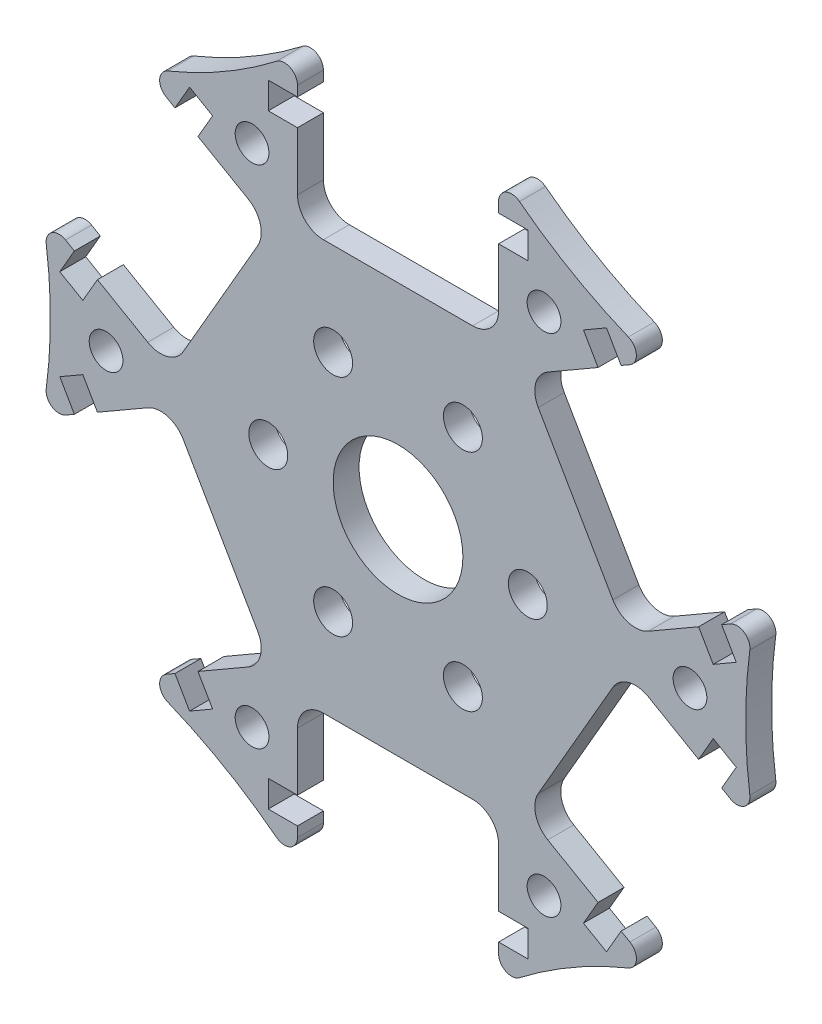
from build123d import *

# Parameters (mm, degrees)
SKETCH_1_R          = 28.3
EXTRUDE_1_DEPTH     = 2
SKETCH_2_R          = 5
SKETCH_2_R_2        = 1.5
SKETCH_2_R_3        = 1.3
CUT_EXTRUDE_1_DEPTH = 41.072184867
CUT_EXTRUDE_3_DEPTH = 40.315613947
FILLET_2_R          = 2
FILLET_1_R          = 1


with BuildPart() as part:
    # ｽｹｯﾁ1 → ﾎﾞｽ - 押し出し1 (new body)
    with BuildSketch(Plane.XY):
        Circle(SKETCH_1_R)
    extrude(amount=EXTRUDE_1_DEPTH)

    # ｽｹｯﾁ2 → ｶｯﾄ - 押し出し1 (cut, through all)
    with BuildSketch(Plane.XY.offset(2)):
        Circle(SKETCH_2_R)
        with Locations((5, 8.660254038)):
            Circle(SKETCH_2_R_2)
        with Locations((10, 0)):
            Circle(SKETCH_2_R_2)
        with Locations((5, -8.660254038)):
            Circle(SKETCH_2_R_2)
        with Locations((-5, -8.660254038)):
            Circle(SKETCH_2_R_2)
        with Locations((-10, 0)):
            Circle(SKETCH_2_R_2)
        with Locations((-5, 8.660254038)):
            Circle(SKETCH_2_R_2)
        with Locations((11.25, 19.485571585)):
            Circle(SKETCH_2_R_3)
        with Locations((22.5, 0)):
            Circle(SKETCH_2_R_3)
        with Locations((11.25, -19.485571585)):
            Circle(SKETCH_2_R_3)
        with Locations((-11.25, -19.485571585)):
            Circle(SKETCH_2_R_3)
        with Locations((-22.5, 0)):
            Circle(SKETCH_2_R_3)
        with Locations((-11.25, 19.485571585)):
            Circle(SKETCH_2_R_3)
        with BuildLine():
            Line((7.75, 24.325), (10, 24.325))
            Line((10, 24.325), (10, 22.275))
            Line((10, 22.275), (7.75, 22.275))
            Line((7.75, 22.275), (7.75, 15.8))
            Line((7.75, 15.8), (-7.75, 15.8))
            Line((-7.75, 15.8), (-7.75, 22.275))
            Line((-7.75, 22.275), (-10, 22.275))
            Line((-10, 22.275), (-10, 24.325))
            Line((-10, 24.325), (-7.75, 24.325))
            Line((-7.75, 24.325), (-7.75, 27.21814652))
            ThreePointArc((-7.75, 27.21814652), (0, 28.3), (7.75, 27.21814652))
            Line((7.75, 27.21814652), (7.75, 24.325))
        make_face()
        with BuildLine():
            Line((24.941067947, 5.450803121), (26.066067947, 3.502245962))
            Line((26.066067947, 3.502245962), (24.290715869, 2.477245962))
            Line((24.290715869, 2.477245962), (23.165715869, 4.425803121))
            Line((23.165715869, 4.425803121), (17.55820138, 1.188303121))
            Line((17.55820138, 1.188303121), (9.80820138, 14.611696879))
            Line((9.80820138, 14.611696879), (15.415715869, 17.849196879))
            Line((15.415715869, 17.849196879), (14.290715869, 19.797754038))
            Line((14.290715869, 19.797754038), (16.066067947, 20.822754038))
            Line((16.066067947, 20.822754038), (17.191067947, 18.874196879))
            Line((17.191067947, 18.874196879), (19.69660633, 20.320770139))
            ThreePointArc((19.69660633, 20.320770139), (24.508518927, 14.15), (27.44660633, 6.897376381))
            Line((27.44660633, 6.897376381), (24.941067947, 5.450803121))
        make_face()
        with BuildLine():
            Line((17.191067947, -18.874196879), (16.066067947, -20.822754038))
            Line((16.066067947, -20.822754038), (14.290715869, -19.797754038))
            Line((14.290715869, -19.797754038), (15.415715869, -17.849196879))
            Line((15.415715869, -17.849196879), (9.80820138, -14.611696879))
            Line((9.80820138, -14.611696879), (17.55820138, -1.188303121))
            Line((17.55820138, -1.188303121), (23.165715869, -4.425803121))
            Line((23.165715869, -4.425803121), (24.290715869, -2.477245962))
            Line((24.290715869, -2.477245962), (26.066067947, -3.502245962))
            Line((26.066067947, -3.502245962), (24.941067947, -5.450803121))
            Line((24.941067947, -5.450803121), (27.44660633, -6.897376381))
            ThreePointArc((27.44660633, -6.897376381), (24.508518927, -14.15), (19.69660633, -20.320770139))
            Line((19.69660633, -20.320770139), (17.191067947, -18.874196879))
        make_face()
        with BuildLine():
            Line((-7.75, -24.325), (-10, -24.325))
            Line((-10, -24.325), (-10, -22.275))
            Line((-10, -22.275), (-7.75, -22.275))
            Line((-7.75, -22.275), (-7.75, -15.8))
            Line((-7.75, -15.8), (7.75, -15.8))
            Line((7.75, -15.8), (7.75, -22.275))
            Line((7.75, -22.275), (10, -22.275))
            Line((10, -22.275), (10, -24.325))
            Line((10, -24.325), (7.75, -24.325))
            Line((7.75, -24.325), (7.75, -27.21814652))
            ThreePointArc((7.75, -27.21814652), (0, -28.3), (-7.75, -27.21814652))
            Line((-7.75, -27.21814652), (-7.75, -24.325))
        make_face()
        with BuildLine():
            Line((-24.941067947, -5.450803121), (-26.066067947, -3.502245962))
            Line((-26.066067947, -3.502245962), (-24.290715869, -2.477245962))
            Line((-24.290715869, -2.477245962), (-23.165715869, -4.425803121))
            Line((-23.165715869, -4.425803121), (-17.55820138, -1.188303121))
            Line((-17.55820138, -1.188303121), (-9.80820138, -14.611696879))
            Line((-9.80820138, -14.611696879), (-15.415715869, -17.849196879))
            Line((-15.415715869, -17.849196879), (-14.290715869, -19.797754038))
            Line((-14.290715869, -19.797754038), (-16.066067947, -20.822754038))
            Line((-16.066067947, -20.822754038), (-17.191067947, -18.874196879))
            Line((-17.191067947, -18.874196879), (-19.69660633, -20.320770139))
            ThreePointArc((-19.69660633, -20.320770139), (-24.508518927, -14.15), (-27.44660633, -6.897376381))
            Line((-27.44660633, -6.897376381), (-24.941067947, -5.450803121))
        make_face()
        with BuildLine():
            Line((-17.191067947, 18.874196879), (-16.066067947, 20.822754038))
            Line((-16.066067947, 20.822754038), (-14.290715869, 19.797754038))
            Line((-14.290715869, 19.797754038), (-15.415715869, 17.849196879))
            Line((-15.415715869, 17.849196879), (-9.80820138, 14.611696879))
            Line((-9.80820138, 14.611696879), (-17.55820138, 1.188303121))
            Line((-17.55820138, 1.188303121), (-23.165715869, 4.425803121))
            Line((-23.165715869, 4.425803121), (-24.290715869, 2.477245962))
            Line((-24.290715869, 2.477245962), (-26.066067947, 3.502245962))
            Line((-26.066067947, 3.502245962), (-24.941067947, 5.450803121))
            Line((-24.941067947, 5.450803121), (-27.44660633, 6.897376381))
            ThreePointArc((-27.44660633, 6.897376381), (-24.508518927, 14.15), (-19.69660633, 20.320770139))
            Line((-19.69660633, 20.320770139), (-17.191067947, 18.874196879))
        make_face()
    extrude(amount=-CUT_EXTRUDE_1_DEPTH, mode=Mode.SUBTRACT)

    # ｽｹｯﾁ3 → ｶｯﾄ - 押し出し3 (cut, through all)
    with BuildSketch(Plane.XY.offset(2)):
        with BuildLine():
            ThreePointArc((7.75, 27.21814652), (13.394592318, 23.200114441), (19.69660633, 20.320770139))
            ThreePointArc((19.69660633, 20.320770139), (14.15, 24.508518927), (7.75, 27.21814652))
        make_face()
        with BuildLine():
            ThreePointArc((27.44660633, 6.897376381), (26.789184636, 0), (27.44660633, -6.897376381))
            ThreePointArc((27.44660633, -6.897376381), (28.3, 0), (27.44660633, 6.897376381))
        make_face()
        with BuildLine():
            ThreePointArc((19.69660633, -20.320770139), (13.394592318, -23.200114441), (7.75, -27.21814652))
            ThreePointArc((7.75, -27.21814652), (14.15, -24.508518927), (19.69660633, -20.320770139))
        make_face()
        with BuildLine():
            ThreePointArc((-7.75, -27.21814652), (-13.394592318, -23.200114441), (-19.69660633, -20.320770139))
            ThreePointArc((-19.69660633, -20.320770139), (-14.15, -24.508518927), (-7.75, -27.21814652))
        make_face()
        with BuildLine():
            ThreePointArc((-27.44660633, -6.897376381), (-26.789184636, 0), (-27.44660633, 6.897376381))
            ThreePointArc((-27.44660633, 6.897376381), (-28.3, 0), (-27.44660633, -6.897376381))
        make_face()
        with BuildLine():
            ThreePointArc((-19.69660633, 20.320770139), (-13.394592318, 23.200114441), (-7.75, 27.21814652))
            ThreePointArc((-7.75, 27.21814652), (-14.15, 24.508518927), (-19.69660633, 20.320770139))
        make_face()
    extrude(amount=-CUT_EXTRUDE_3_DEPTH, mode=Mode.SUBTRACT)

    # ﾌｨﾚｯﾄ2
    fillet_2_edges = [part.edges().sort_by_distance(p)[0] for p in [
        (9.80820138, -14.611696879, 1),
        (17.55820138, -1.188303121, 1),
        (17.55820138, 1.188303121, 1),
        (9.80820138, 14.611696879, 1),
        (7.75, 15.8, 1),
        (-7.75, 15.8, 1),
        (-9.80820138, 14.611696879, 1),
        (-17.55820138, 1.188303121, 1),
        (-7.75, -15.8, 1),
        (7.75, -15.8, 1),
        (-17.55820138, -1.188303121, 1),
        (-9.80820138, -14.611696879, 1),
    ]]
    fillet(fillet_2_edges, radius=FILLET_2_R)

    # ﾌｨﾚｯﾄ1
    fillet_1_edges = [part.edges().sort_by_distance(p)[0] for p in [
        (27.44660633, -6.897376381, 1),
        (19.69660633, -20.320770139, 1),
        (19.69660633, 20.320770139, 1),
        (27.44660633, 6.897376381, 1),
        (-7.75, 27.21814652, 1),
        (7.75, 27.21814652, 1),
        (-27.44660633, 6.897376381, 1),
        (-19.69660633, 20.320770139, 1),
        (7.75, -27.21814652, 1),
        (-7.75, -27.21814652, 1),
        (-19.69660633, -20.320770139, 1),
        (-27.44660633, -6.897376381, 1),
    ]]
    fillet(fillet_1_edges, radius=FILLET_1_R)


solid = part.part
